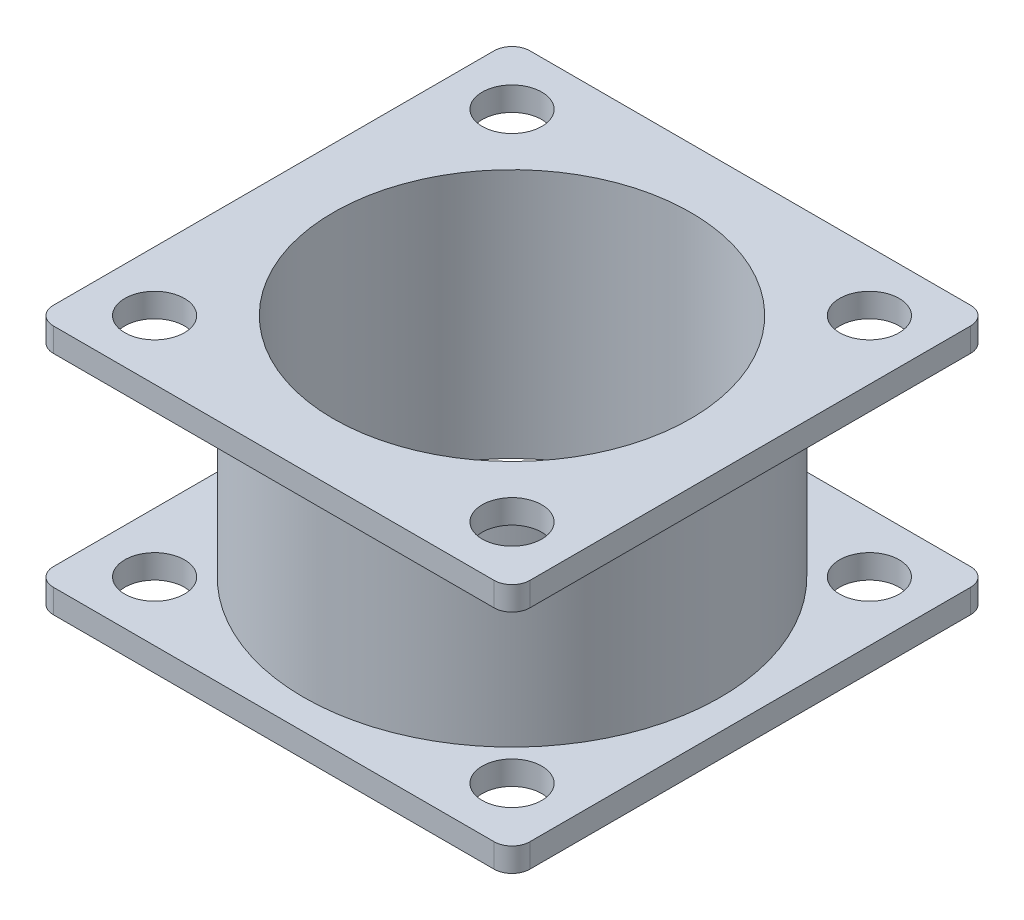
from build123d import *

# Parameters (mm, degrees)
SKETCH1_W           = 80
SKETCH1_H           = 80
BOSS_EXTRUDE1_DEPTH = 4
FILLET3_R           = 3
FILLET2_R           = 3
SKETCH3_R           = 35
BOSS_EXTRUDE3_DEPTH = 17
SKETCH4_W           = 80
SKETCH4_H           = 80
BOSS_EXTRUDE4_DEPTH = 4
FILLET4_R           = 3
SKETCH5_R           = 30
CUT_EXTRUDE1_DEPTH  = 71.455659815
SKETCH6_R           = 5
CUT_EXTRUDE2_DEPTH  = 71.455659815


with BuildPart() as part:
    # Sketch1 → Boss-Extrude1 (new body)
    with BuildSketch(Plane(origin=(0, 0, 0), x_dir=(1, 0, 0), z_dir=(0, 1, 0))):
        Rectangle(SKETCH1_W, SKETCH1_H)
    extrude(amount=BOSS_EXTRUDE1_DEPTH)

    # Fillet3
    fillet3_edges = [part.edges().sort_by_distance(p)[0] for p in [
        (40, 2, 40),
    ]]
    fillet(fillet3_edges, radius=FILLET3_R)

    # Fillet2
    fillet2_edges = [part.edges().sort_by_distance(p)[0] for p in [
        (-40, 2, -40),
        (40, 2, -40),
        (-40, 2, 40),
    ]]
    fillet(fillet2_edges, radius=FILLET2_R)

    # Sketch3 → Boss-Extrude3 (add)
    with BuildSketch(Plane(origin=(0, 4, 0), x_dir=(1, 0, 0), z_dir=(0, 1, 0))):
        with Locations(Location((0, 0, 0), (0, 0, 270))):
            Circle(SKETCH3_R)
    boss_extrude3 = extrude(amount=BOSS_EXTRUDE3_DEPTH)

    # Mirror1: Boss-Extrude3 across plane
    add(boss_extrude3.mirror(Plane.ZX.offset(21)))

    # Sketch4 → Boss-Extrude4 (add)
    with BuildSketch(Plane(origin=(0, 38, 0), x_dir=(1, 0, 0), z_dir=(0, 1, 0))):
        Rectangle(SKETCH4_W, SKETCH4_H)
    extrude(amount=BOSS_EXTRUDE4_DEPTH)

    # Fillet4
    fillet4_edges = [part.edges().sort_by_distance(p)[0] for p in [
        (-40, 40, -40),
        (-40, 40, 40),
        (40, 40, 40),
        (40, 40, -40),
    ]]
    fillet(fillet4_edges, radius=FILLET4_R)

    # Sketch5 → Cut-Extrude1 (cut, through all)
    with BuildSketch(Plane(origin=(0, 42, 0), x_dir=(1, 0, 0), z_dir=(0, 1, 0))):
        with Locations(Location((0, 0, 0), (0, 0, 270))):
            Circle(SKETCH5_R)
    extrude(amount=-CUT_EXTRUDE1_DEPTH, mode=Mode.SUBTRACT)

    # Sketch6 → Cut-Extrude2 (cut, through all)
    with BuildSketch(Plane(origin=(0, 42, 0), x_dir=(1, 0, 0), z_dir=(0, 1, 0))):
        with Locations(Location((30, 30, 0), (0, 0, 270))):
            Circle(SKETCH6_R)
        with Locations(Location((30, -30, 0), (0, 0, 270))):
            Circle(SKETCH6_R)
        with Locations(Location((-30, -30, 0), (0, 0, 270))):
            Circle(SKETCH6_R)
        with Locations(Location((-30, 30, 0), (0, 0, 270))):
            Circle(SKETCH6_R)
    extrude(amount=-CUT_EXTRUDE2_DEPTH, mode=Mode.SUBTRACT)


solid = part.part
